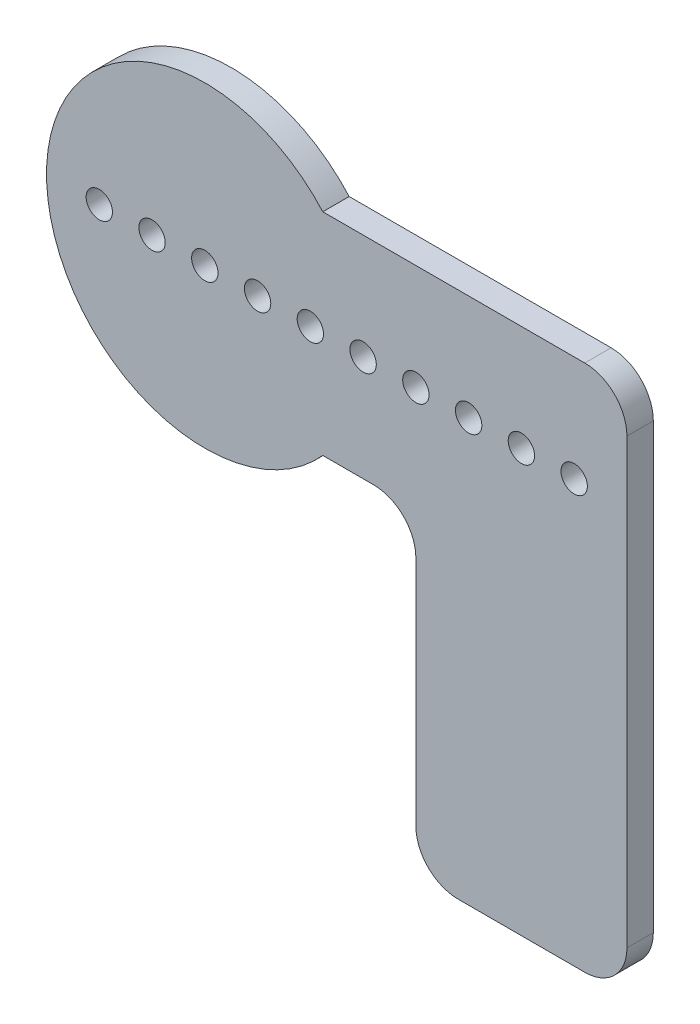
from build123d import *

# Parameters (mm, degrees)
SKETCH1_W           = 25.4
SKETCH1_H           = 63.5
BOSS_EXTRUDE1_DEPTH = 3.175
FILLET1_R           = 5.08
SKETCH2_R           = 1.5875
CUT_EXTRUDE1_DEPTH  = 3.175


with BuildPart() as part:
    # Sketch1 → Boss-Extrude1 (new body)
    with BuildSketch(Plane.XY):
        with BuildLine():
            ThreePointArc((-36.600968343, 63.5), (-69.85, 50.8), (-36.600968343, 38.1))
            Line((-36.600968343, 38.1), (-50.8, 38.1))
            Line((-50.8, 38.1), (-50.8, 63.5))
            Line((-50.8, 63.5), (-36.600968343, 63.5))
        make_face()
        with BuildLine():
            Line((-50.8, 38.1), (-36.600968343, 38.1))
            ThreePointArc((-36.600968343, 38.1), (-33.004016562, 44.00253919), (-31.75, 50.8))
            ThreePointArc((-31.75, 50.8), (-33.004016562, 57.59746081), (-36.600968343, 63.5))
            Line((-36.600968343, 63.5), (-50.8, 63.5))
            Line((-50.8, 63.5), (-50.8, 38.1))
        make_face()
        with BuildLine():
            Line((-36.600968343, 38.1), (-25.4, 38.1))
            Line((-25.4, 38.1), (-25.4, 63.5))
            Line((-25.4, 63.5), (-36.600968343, 63.5))
            ThreePointArc((-36.600968343, 63.5), (-33.004016562, 57.59746081), (-31.75, 50.8))
            ThreePointArc((-31.75, 50.8), (-33.004016562, 44.00253919), (-36.600968343, 38.1))
        make_face()
        with Locations((-12.7, 31.75)):
            Rectangle(SKETCH1_W, SKETCH1_H)
    extrude(amount=BOSS_EXTRUDE1_DEPTH)

    # Fillet1
    fillet1_edges = [part.edges().sort_by_distance(p)[0] for p in [
        (0, 63.5, 1.5875),
        (0, 0, 1.5875),
        (-25.4, 0, 1.5875),
        (-25.4, 38.1, 1.5875),
    ]]
    fillet(fillet1_edges, radius=FILLET1_R)

    # Sketch2 → Cut-Extrude1 (cut)
    with BuildSketch(Plane.XY.offset(3.175)):
        with Locations((-6.35, 50.8)):
            Circle(SKETCH2_R)
        with Locations((-12.7, 50.8)):
            Circle(SKETCH2_R)
        with Locations((-19.05, 50.8)):
            Circle(SKETCH2_R)
        with Locations((-25.4, 50.8)):
            Circle(SKETCH2_R)
        with Locations((-31.75, 50.8)):
            Circle(SKETCH2_R)
        with Locations((-38.1, 50.8)):
            Circle(SKETCH2_R)
        with Locations((-44.45, 50.8)):
            Circle(SKETCH2_R)
        with Locations((-50.8, 50.8)):
            Circle(SKETCH2_R)
        with Locations((-57.15, 50.8)):
            Circle(SKETCH2_R)
        with Locations((-63.5, 50.8)):
            Circle(SKETCH2_R)
    extrude(amount=-CUT_EXTRUDE1_DEPTH, mode=Mode.SUBTRACT)


solid = part.part
